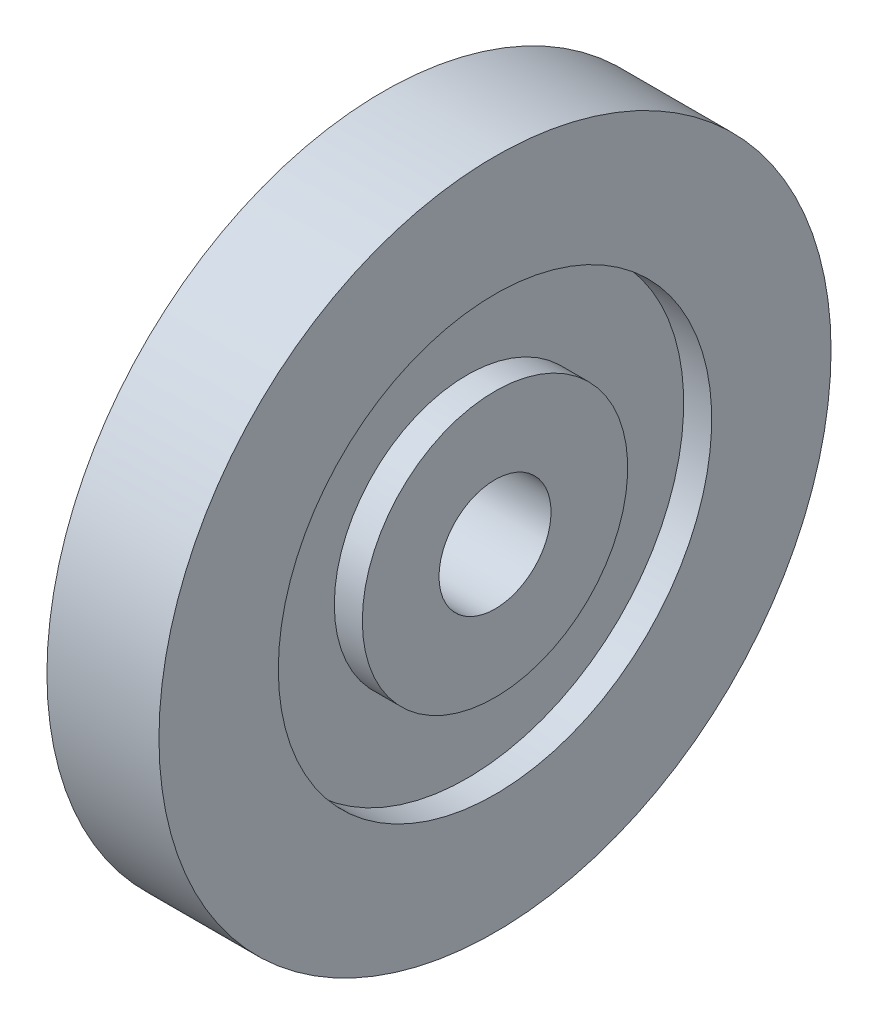
from build123d import *


with BuildPart() as part:
    # Esquisse1 → Revolve1 (revolve)
    with BuildSketch(Plane.XY, mode=Mode.PRIVATE) as revolve1_sk:
        Polygon((-2, -10.429754226), (2, -10.429754226), (2, -7.691443281), (1, -7.691443281), (1, -4.691443281), (2, -4.691443281), (2, -0.429754226), (-2, -0.429754226), (-2, -4.691443281), (-1, -4.691443281), (-1, -7.691443281), (-2, -7.691443281), align=None)
    revolve(revolve1_sk.sketch.rotate(Axis((2, -12.429754226, 0), (1, 0, 0)), 90), axis=Axis((2, -12.429754226, 0), (1, 0, 0)))


solid = part.part
